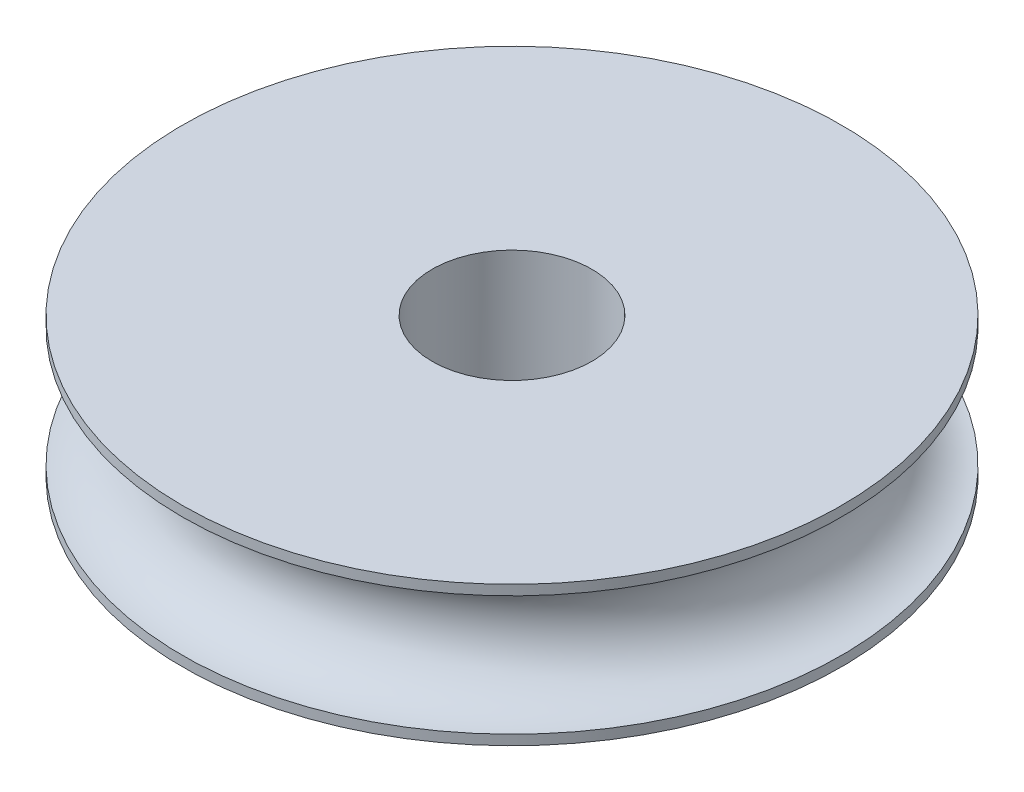
from build123d import *

# Parameters (mm, degrees)
SKETCH2_R           = 16.5
BOSS_EXTRUDE1_DEPTH = 0.5
BOSS_EXTRUDE2_START = 0.5
SKETCH3_R           = 16.5
BOSS_EXTRUDE2_DEPTH = 0.5
SKETCH4_R           = 1
CUT_EXTRUDE1_DEPTH  = 7
SKETCH5_R           = 4
CUT_EXTRUDE2_DEPTH  = 10


with BuildPart() as part:
    # Sketch1 → Revolve1 (revolve)
    with BuildSketch(Plane.XY, mode=Mode.PRIVATE) as revolve1_sk:
        Polygon((0, 6), (0, 0), (13.5, 0), (13.5, 3), (13.5, 6), align=None)
        with BuildLine():
            Line((13.5, 6), (13.5, 3))
            ThreePointArc((13.5, 3), (14.378679656, 5.121320344), (16.5, 6))
            Line((16.5, 6), (13.5, 6))
        make_face()
        with BuildLine():
            Line((13.5, 3), (13.5, 0))
            Line((13.5, 0), (16.5, 0))
            ThreePointArc((16.5, 0), (14.378679656, 0.878679656), (13.5, 3))
        make_face()
    revolve(revolve1_sk.sketch.rotate(Axis((0, 0, 0), (0, 1, 0)), 90), axis=Axis((0, 0, 0), (0, 1, 0)))

    # Sketch2 → Boss-Extrude1 (add)
    with BuildSketch(Plane(origin=(0, 6, 0), x_dir=(1, 0, 0), z_dir=(0, 1, 0))):
        with Locations(Location((0, 0, 0), (0, 0, 270))):
            Circle(SKETCH2_R)
    extrude(amount=BOSS_EXTRUDE1_DEPTH)

    # Sketch3 → Boss-Extrude2 (add)
    with BuildSketch(Plane.XZ.offset(BOSS_EXTRUDE2_START)):
        with Locations(Location((0, 0, 0), (0, 0, 90))):
            Circle(SKETCH3_R)
    extrude(amount=-BOSS_EXTRUDE2_DEPTH)

    # Sketch4 → Cut-Extrude1 (cut)
    with BuildSketch(Plane.XZ.offset(0.5)):
        with Locations(Location((0, 0, 0), (0, 0, 270))):
            Circle(SKETCH4_R)
    extrude(amount=-CUT_EXTRUDE1_DEPTH, mode=Mode.SUBTRACT)

    # Sketch5 → Cut-Extrude2 (cut)
    with BuildSketch(Plane(origin=(0, 6.5, 0), x_dir=(1, 0, 0), z_dir=(0, 1, 0))):
        with Locations(Location((0, 0, 0), (0, 0, 270))):
            Circle(SKETCH5_R)
    extrude(amount=-CUT_EXTRUDE2_DEPTH, mode=Mode.SUBTRACT)


solid = part.part
